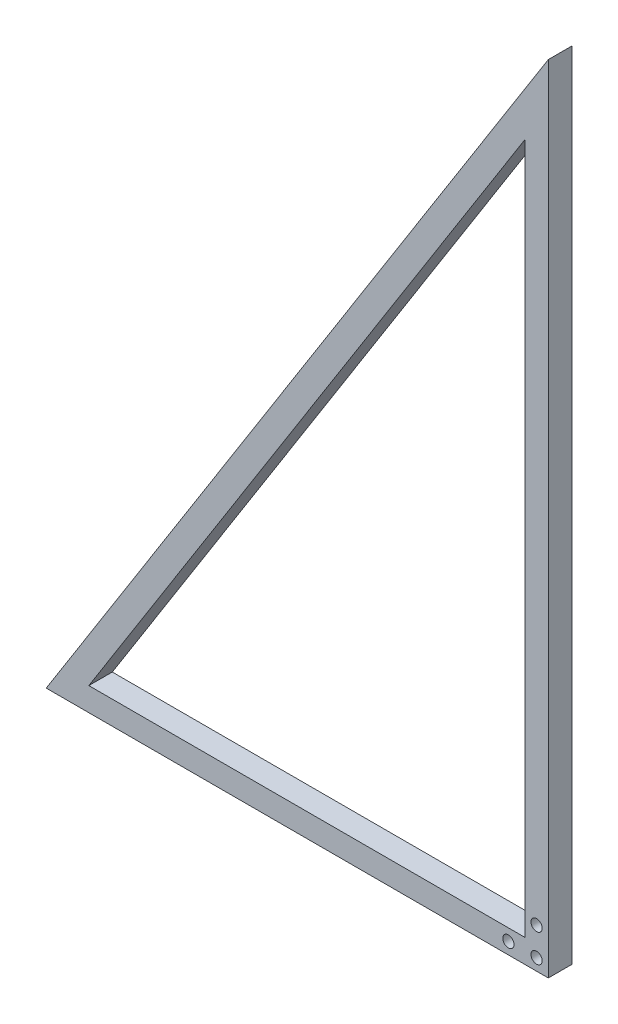
from build123d import *

# Parameters (mm, degrees)
CROQUIS1_W              = 6.25
CROQUIS1_H              = 200
SALIENTE_EXTRUIR1_DEPTH = 3.125
CORTAR_EXTRUIR1_DEPTH   = 6.25
CROQUIS4_W              = 120
CROQUIS4_H              = 6.25
SALIENTE_EXTRUIR2_DEPTH = 6.25
SALIENTE_EXTRUIR3_DEPTH = 6.25
SALIENTE_EXTRUIR4_DEPTH = 6.25
CROQUIS10_R             = 1.5
CORTAR_EXTRUIR3_DEPTH   = 16.25


with BuildPart() as part:
    # Croquis1 → Saliente-Extruir1 (new, symmetric)
    with BuildSketch(Plane.XY):
        Rectangle(CROQUIS1_W, CROQUIS1_H)
    extrude(amount=SALIENTE_EXTRUIR1_DEPTH, both=True)

    # Croquis3 → Cortar-Extruir1 (cut)
    with BuildSketch(Plane.XY.offset(3.125)):
        Polygon((3.125, 100), (-3.125, 93.75), (-3.125, 100), align=None)
    extrude(amount=-CORTAR_EXTRUIR1_DEPTH, mode=Mode.SUBTRACT)

    # Croquis4 → Saliente-Extruir2 (add)
    with BuildSketch(Plane.XY.offset(3.125)):
        with Locations((-63.125, -96.875)):
            Rectangle(CROQUIS4_W, CROQUIS4_H)
    extrude(amount=-SALIENTE_EXTRUIR2_DEPTH)

    # Croquis7 → Saliente-Extruir3 (add)
    with BuildSketch(Plane.XY.offset(3.125)):
        Polygon((-123.125, -100), (3.125, 100), (-2.160090412, 103.336213323), (-130.516075072, -100), align=None)
    extrude(amount=-SALIENTE_EXTRUIR3_DEPTH)

    # Croquis9 → Saliente-Extruir4 (add)
    with BuildSketch(Plane.XY.offset(3.125)):
        Polygon((3.125, 100), (-2.160090412, 103.336213323), (3.125, 111.708633778), align=None)
    extrude(amount=-SALIENTE_EXTRUIR4_DEPTH)

    # Croquis10 → Cortar-Extruir3 (cut)
    with BuildSketch(Plane.XY.offset(3.125)):
        with Locations((0, -96.875)):
            Circle(CROQUIS10_R)
        with Locations((0, -89.375)):
            Circle(CROQUIS10_R)
        with Locations((-7.5, -96.875)):
            Circle(CROQUIS10_R)
    extrude(amount=-CORTAR_EXTRUIR3_DEPTH, mode=Mode.SUBTRACT)


solid = part.part
